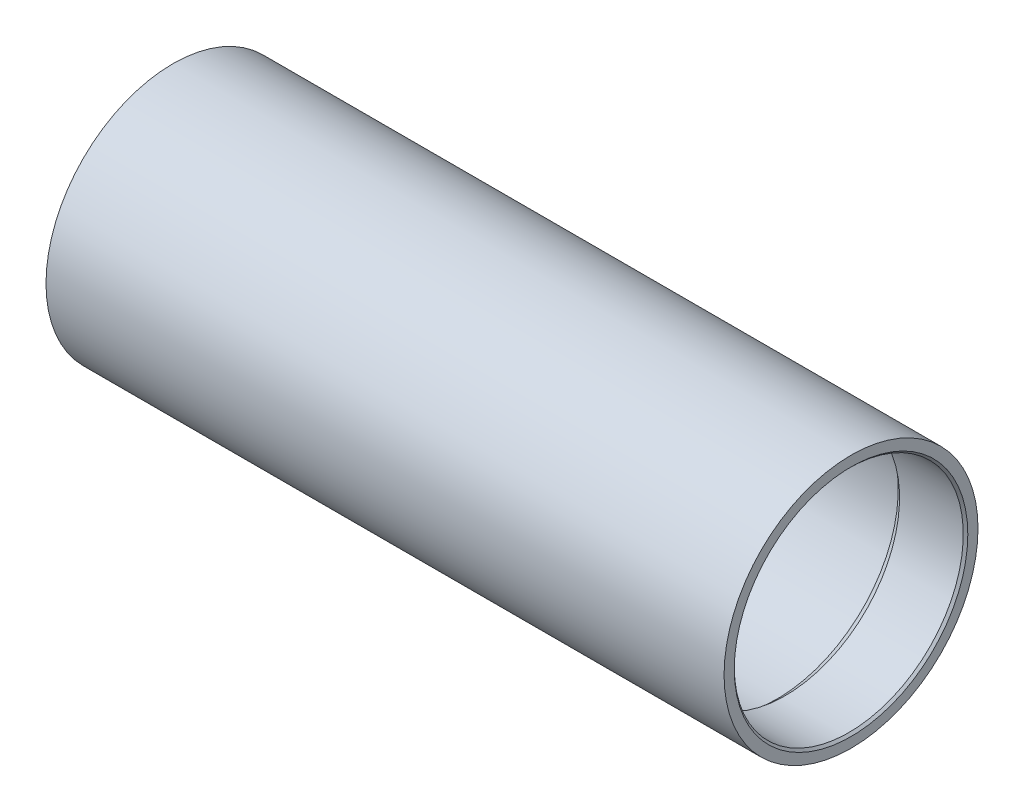
from build123d import *

# Parameters (mm, degrees)
CHAMFER1_SIZE = 1


with BuildPart() as part:
    # Sketch1 → Revolve1 (revolve)
    with BuildSketch(Plane.XY, mode=Mode.PRIVATE) as revolve1_sk:
        Polygon((0, 55.8), (298, 55.8), (298, 50.325), (269, 50.325), (265.502203206, 53.26), (163.396365166, 53.26), (161.5, 51), (136.5, 51), (133.806636881, 53.26), (32.497796794, 53.26), (29, 50.325), (0, 50.325), align=None)
    revolve(revolve1_sk.sketch.rotate(Axis((0, 0, 0), (1, 0, 0)), 90), axis=Axis((0, 0, 0), (1, 0, 0)))

    # Chamfer1
    chamfer1_edges = [part.edges().sort_by_distance(p)[0] for p in [
        (0, 0, -50.325),
        (298, 0, -50.325),
    ]]
    chamfer(chamfer1_edges, length=CHAMFER1_SIZE)


solid = part.part
